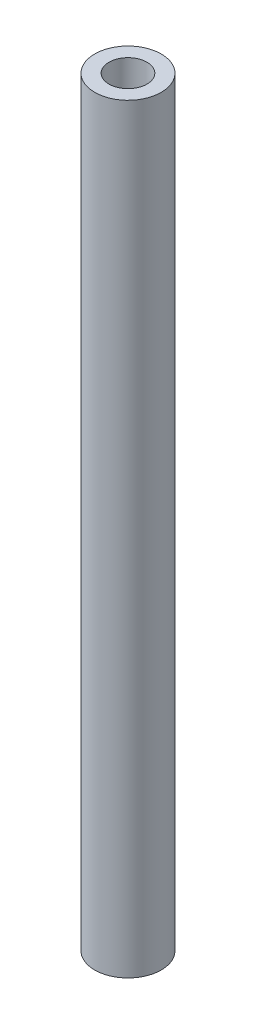
from build123d import *

# Parameters (mm, degrees)
SKETCH_1_R      = 1.75
SKETCH_1_R_2    = 1
EXTRUDE_1_DEPTH = 40


with BuildPart() as part:
    # 草图1 → 凸台-拉伸1 (new body)
    with BuildSketch(Plane(origin=(0, 0, 0), x_dir=(1, 0, 0), z_dir=(0, 1, 0))):
        with Locations(Location((0, 0, 0), (0, 0, 270))):
            Circle(SKETCH_1_R)
        with Locations(Location((0, 0, 0), (0, 0, 270))):
            Circle(SKETCH_1_R_2, mode=Mode.SUBTRACT)
    extrude(amount=EXTRUDE_1_DEPTH)


solid = part.part
